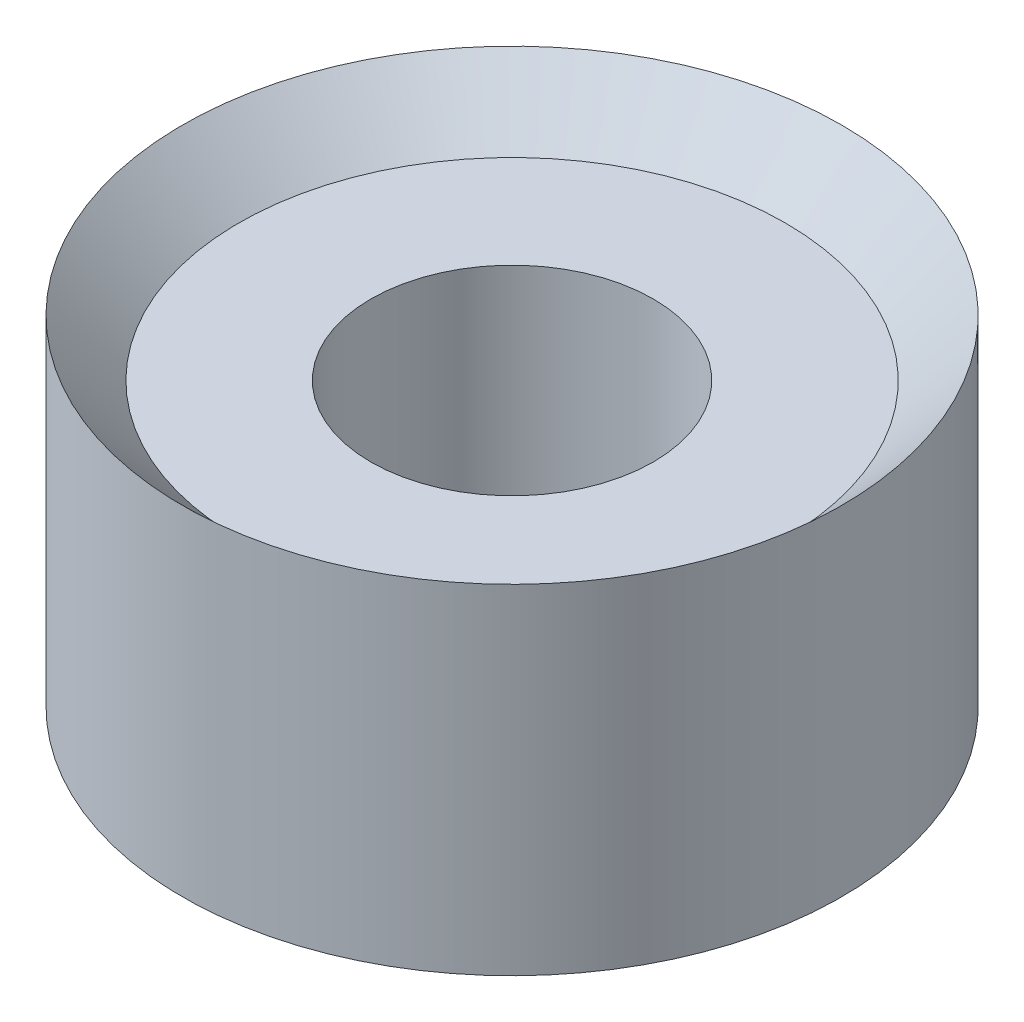
from build123d import *


with BuildPart() as part:
    # Sketch1 → Revolve1 (revolve)
    with BuildSketch(Plane.XY, mode=Mode.PRIVATE) as revolve1_sk:
        Polygon((-7.5, 0), (-17.5, 0), (-17.5, 18), (-14.5, 15), (-7.5, 15), align=None)
    revolve(revolve1_sk.sketch.rotate(Axis((0, -0.9, 0), (0, 1, 0)), 270), axis=Axis((0, -0.9, 0), (0, 1, 0)))


solid = part.part
